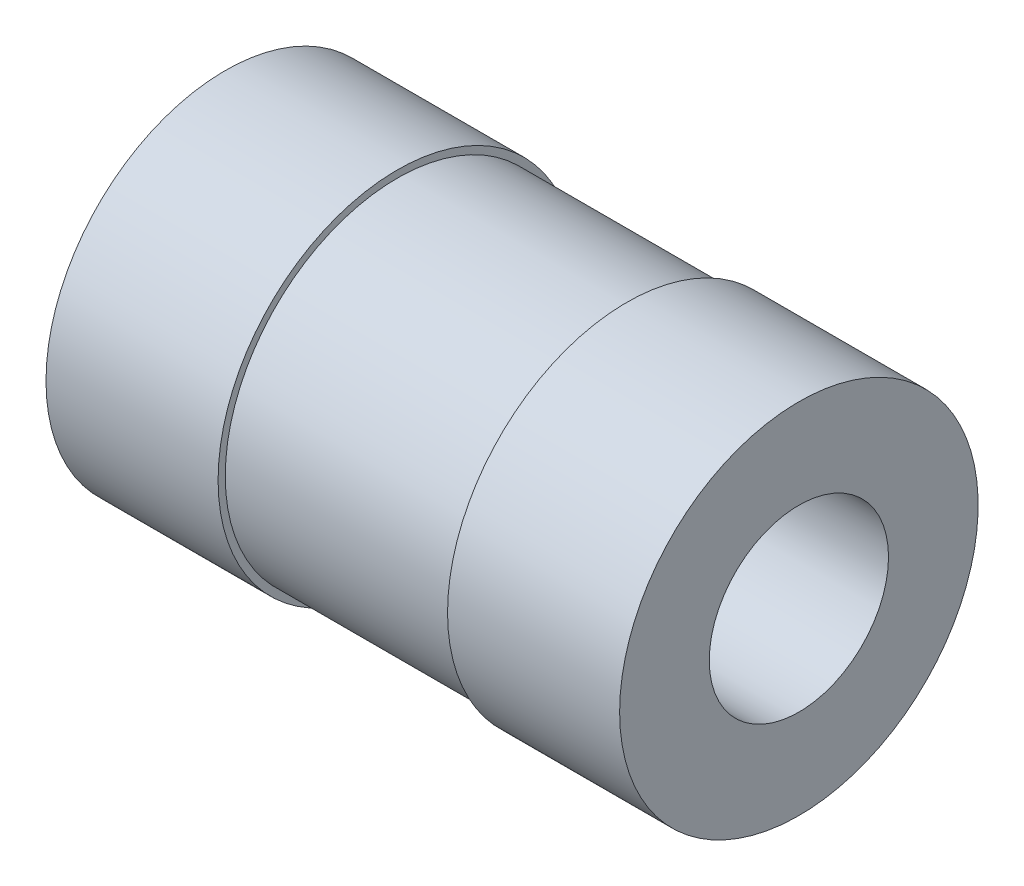
from build123d import *


with BuildPart() as part:
    # 草图1 → 旋转1 (revolve)
    with BuildSketch(Plane.XY, mode=Mode.PRIVATE) as revolve_1_sk:
        Polygon((-4, 1.25), (4, 1.25), (4, 2.5), (1.6, 2.5), (1.6, 2.4), (-1.6, 2.4), (-1.6, 2.5), (-4, 2.5), align=None)
    revolve(revolve_1_sk.sketch.rotate(Axis((-2.022624434, 0, 0), (1, 0, 0)), 90), axis=Axis((-2.022624434, 0, 0), (1, 0, 0)))


solid = part.part
